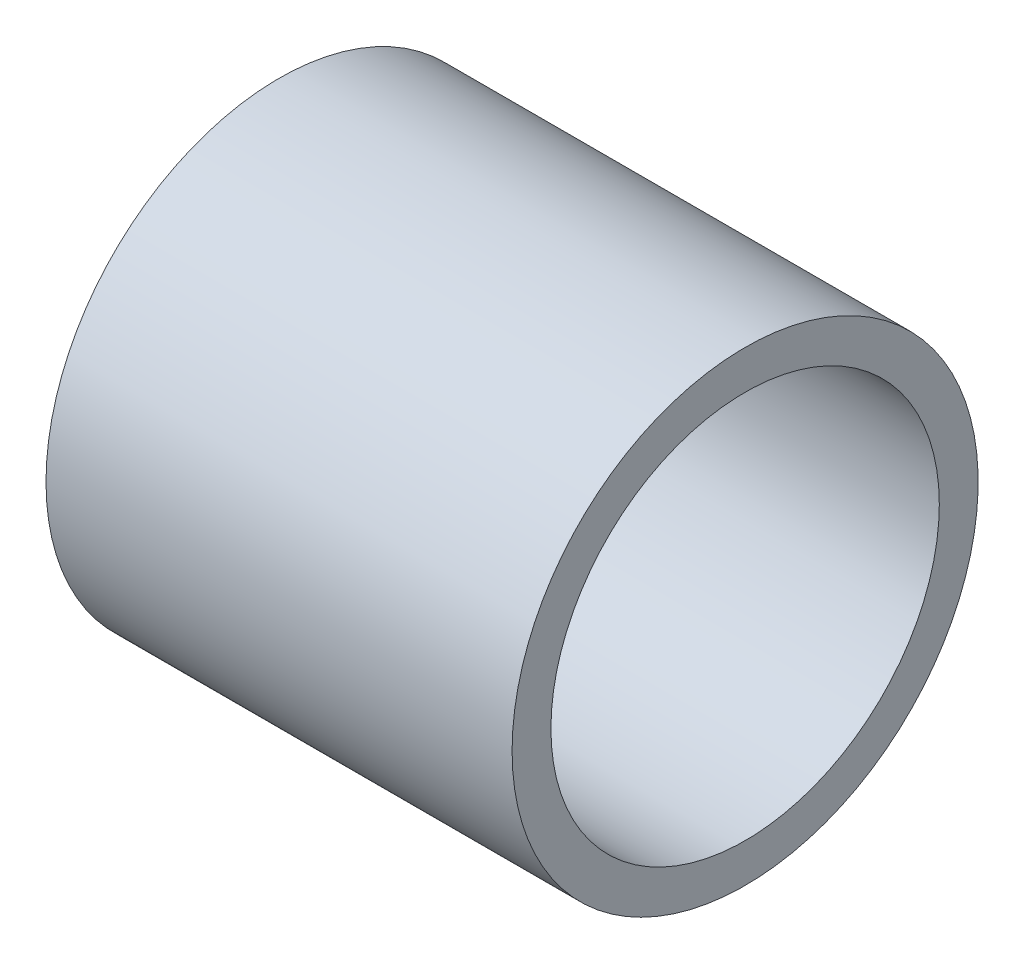
from build123d import *

# Parameters (mm, degrees)
SKETCH1_R           = 1.905
SKETCH1_R_2         = 1.5875
BOSS_EXTRUDE1_DEPTH = 3.81


with BuildPart() as part:
    # Sketch1 → Boss-Extrude1 (new body)
    with BuildSketch(Plane(origin=(0, 0, 0), x_dir=(0, 0, -1), z_dir=(1, 0, 0))):
        Circle(SKETCH1_R)
        Circle(SKETCH1_R_2, mode=Mode.SUBTRACT)
    extrude(amount=BOSS_EXTRUDE1_DEPTH)


solid = part.part
